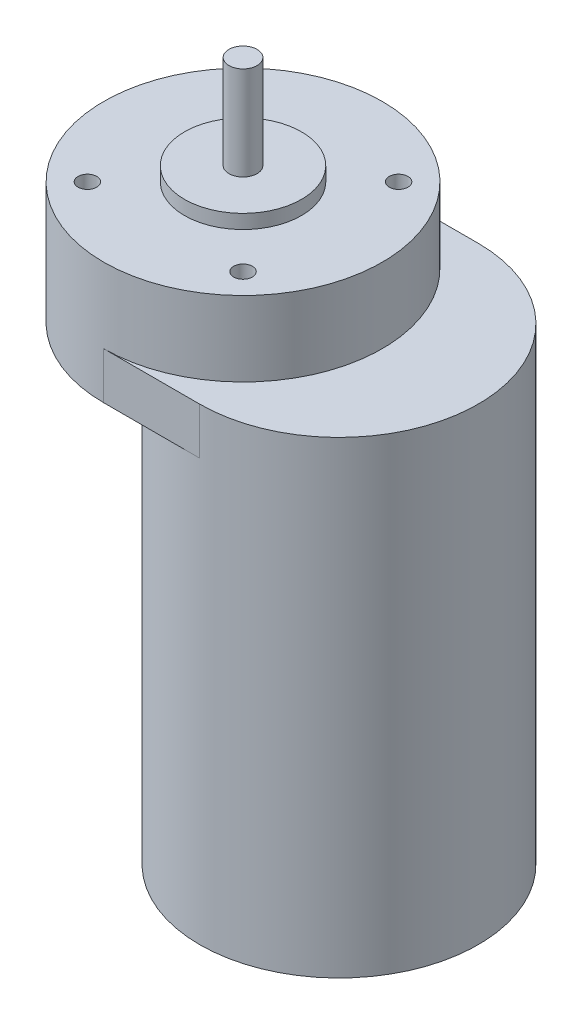
from build123d import *

# Parameters (mm, degrees)
SKETCH1_R           = 29.75
BOSS_EXTRUDE1_DEPTH = 90
BOSS_EXTRUDE2_DEPTH = 10
SKETCH3_R           = 29.75
BOSS_EXTRUDE3_DEPTH = 16
SKETCH4_R           = 12.5
SKETCH4_R_2         = 3
BOSS_EXTRUDE4_DEPTH = 3
SKETCH7_R           = 3
BOSS_EXTRUDE5_DEPTH = 20
SKETCH8_R           = 2
CUT_EXTRUDE1_DEPTH  = 20


with BuildPart() as part:
    # Sketch1 → Boss-Extrude1 (new body)
    with BuildSketch(Plane(origin=(0, 0, 0), x_dir=(1, 0, 0), z_dir=(0, 1, 0))):
        with Locations(Location((0, 0, 0), (0, 0, 90))):
            Circle(SKETCH1_R)
    extrude(amount=BOSS_EXTRUDE1_DEPTH)

    # Sketch2 → Boss-Extrude2 (add)
    with BuildSketch(Plane(origin=(0, 90, 0), x_dir=(1, 0, 0), z_dir=(0, 1, 0))):
        with BuildLine():
            Line((0, -29.75), (-20.5, -29.75))
            ThreePointArc((-20.5, -29.75), (-50.25, 0), (-20.5, 29.75))
            Line((-20.5, 29.75), (0, 29.75))
            ThreePointArc((0, 29.75), (29.75, 0), (0, -29.75))
        make_face()
    extrude(amount=BOSS_EXTRUDE2_DEPTH)

    # Sketch3 → Boss-Extrude3 (add)
    with BuildSketch(Plane(origin=(0, 100, 0), x_dir=(1, 0, 0), z_dir=(0, 1, 0))):
        with Locations(Location((-20.5, 0, 0), (0, 0, 270))):
            Circle(SKETCH3_R)
    extrude(amount=BOSS_EXTRUDE3_DEPTH)

    # Sketch4 → Boss-Extrude4 (add)
    with BuildSketch(Plane(origin=(0, 116, 0), x_dir=(1, 0, 0), z_dir=(0, 1, 0))):
        with Locations(Location((-20.5, 0, 0), (0, 0, 270))):
            Circle(SKETCH4_R)
        with Locations(Location((-20.5, 0, 0), (0, 0, 270))):
            Circle(SKETCH4_R_2, mode=Mode.SUBTRACT)
    extrude(amount=BOSS_EXTRUDE4_DEPTH)

    # Sketch8 → Cut-Extrude1 (cut)
    with BuildSketch(Plane(origin=(0, 116, 0), x_dir=(1, 0, 0), z_dir=(0, 1, 0))):
        with Locations(Location((-37.117009358, 16.617009358, 0), (0, 0, 270))):
            Circle(SKETCH8_R)
        with Locations(Location((-37.117009358, -16.617009358, 0), (0, 0, 270))):
            Circle(SKETCH8_R)
        with Locations(Location((-3.882990642, -16.617009358, 0), (0, 0, 270))):
            Circle(SKETCH8_R)
        with Locations(Location((-3.882990642, 16.617009358, 0), (0, 0, 270))):
            Circle(SKETCH8_R)
    extrude(amount=-CUT_EXTRUDE1_DEPTH, mode=Mode.SUBTRACT)


with BuildPart() as body_2:
    # Sketch7 → Boss-Extrude5 (new body)
    with BuildSketch(Plane(origin=(0, 119, 0), x_dir=(1, 0, 0), z_dir=(0, 1, 0))):
        with Locations(Location((-20.5, 0, 0), (0, 0, 270))):
            Circle(SKETCH7_R)
    extrude(amount=BOSS_EXTRUDE5_DEPTH)


solid = Compound([part.part, body_2.part])
